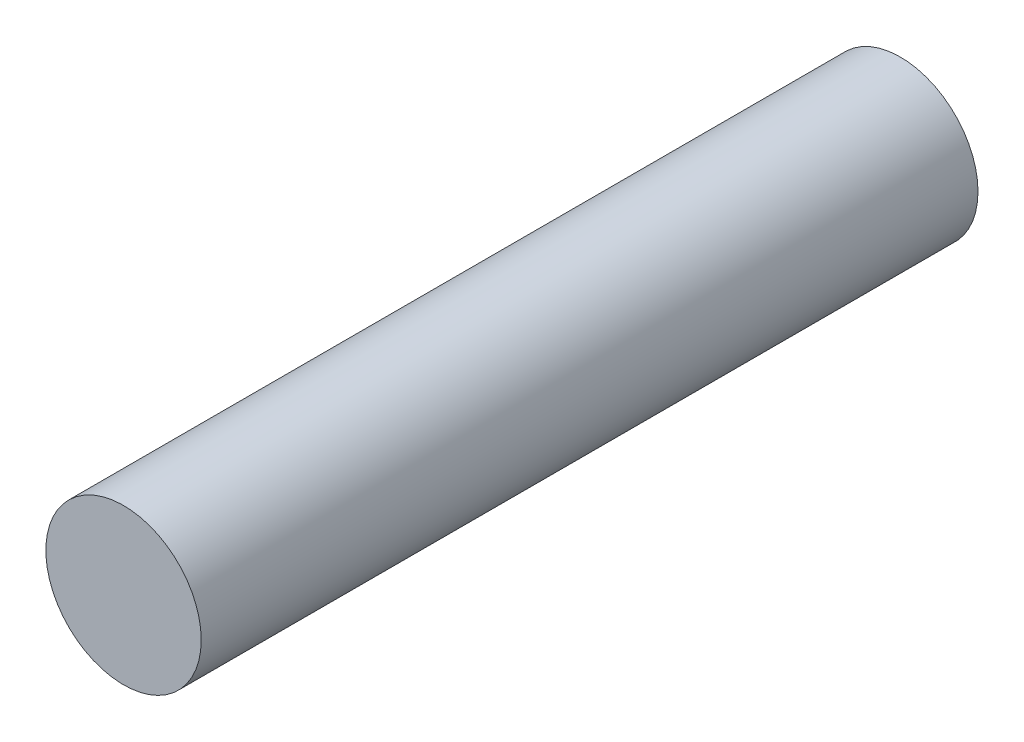
from build123d import *

# Parameters (mm, degrees)
SKETCH1_R           = 0.5
BOSS_EXTRUDE1_DEPTH = 5


with BuildPart() as part:
    # Sketch1 → Boss-Extrude1 (new body)
    with BuildSketch(Plane.XY):
        Circle(SKETCH1_R)
    extrude(amount=BOSS_EXTRUDE1_DEPTH)


solid = part.part
